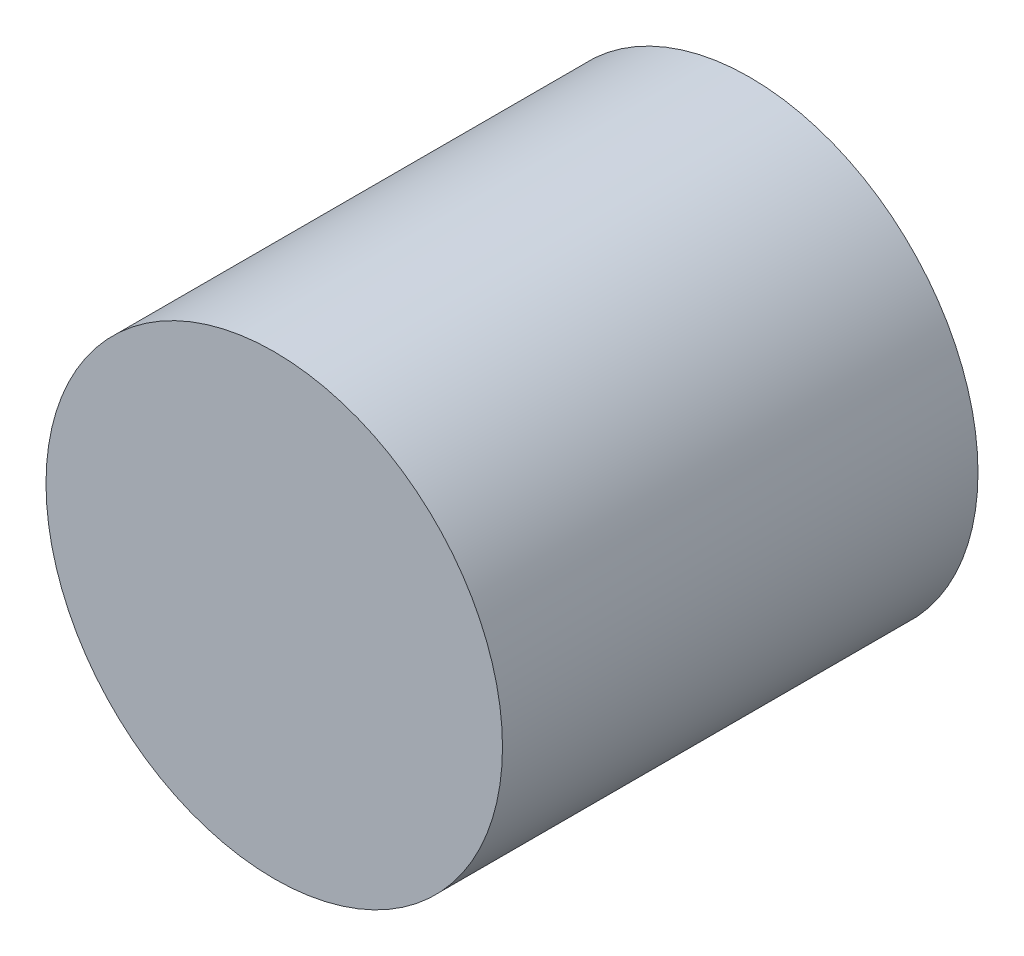
from build123d import *

# Parameters (mm, degrees)
CROQUIS1_R              = 24
SALIENTE_EXTRUIR1_DEPTH = 50
CROQUIS2_R              = 5
CORTAR_EXTRUIR1_DEPTH   = 10


with BuildPart() as part:
    # Croquis1 → Saliente-Extruir1 (new body)
    with BuildSketch(Plane.XY):
        Circle(CROQUIS1_R)
    extrude(amount=SALIENTE_EXTRUIR1_DEPTH)

    # Croquis2 → Cortar-Extruir1 (cut)
    with BuildSketch(Plane(origin=(0, 0, 0), x_dir=(-1, 0, 0), z_dir=(0, 0, -1))):
        Circle(CROQUIS2_R)
    extrude(amount=-CORTAR_EXTRUIR1_DEPTH, mode=Mode.SUBTRACT)


solid = part.part
